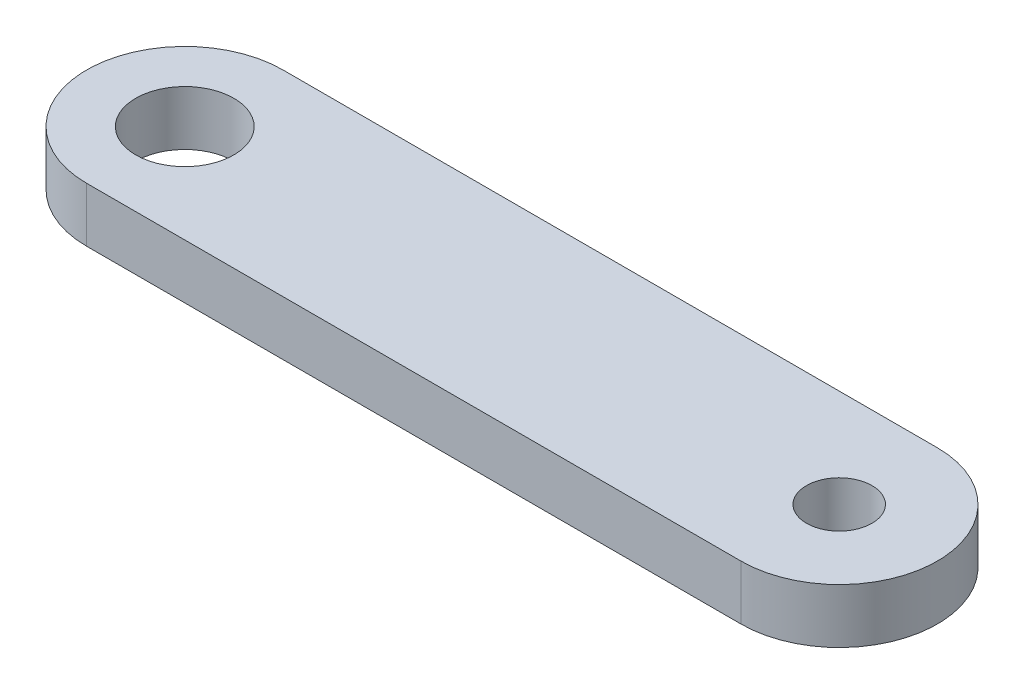
from build123d import *

# Parameters (mm, degrees)
SKETCH1_R           = 4.5
SKETCH1_R_2         = 3
BOSS_EXTRUDE1_DEPTH = 5


with BuildPart() as part:
    # Sketch1 → Boss-Extrude1 (new body)
    with BuildSketch(Plane(origin=(0, 0, 0), x_dir=(1, 0, 0), z_dir=(0, 1, 0))):
        with BuildLine():
            Line((0, 9), (60, 9))
            ThreePointArc((60, 9), (69, 0), (60, -9))
            Line((60, -9), (0, -9))
            ThreePointArc((0, -9), (-9, 0), (0, 9))
        make_face()
        with Locations(Location((0, 0, 0), (0, 0, 270))):
            Circle(SKETCH1_R, mode=Mode.SUBTRACT)
        with Locations(Location((60, 0, 0), (0, 0, 270))):
            Circle(SKETCH1_R_2, mode=Mode.SUBTRACT)
    extrude(amount=BOSS_EXTRUDE1_DEPTH)


solid = part.part
